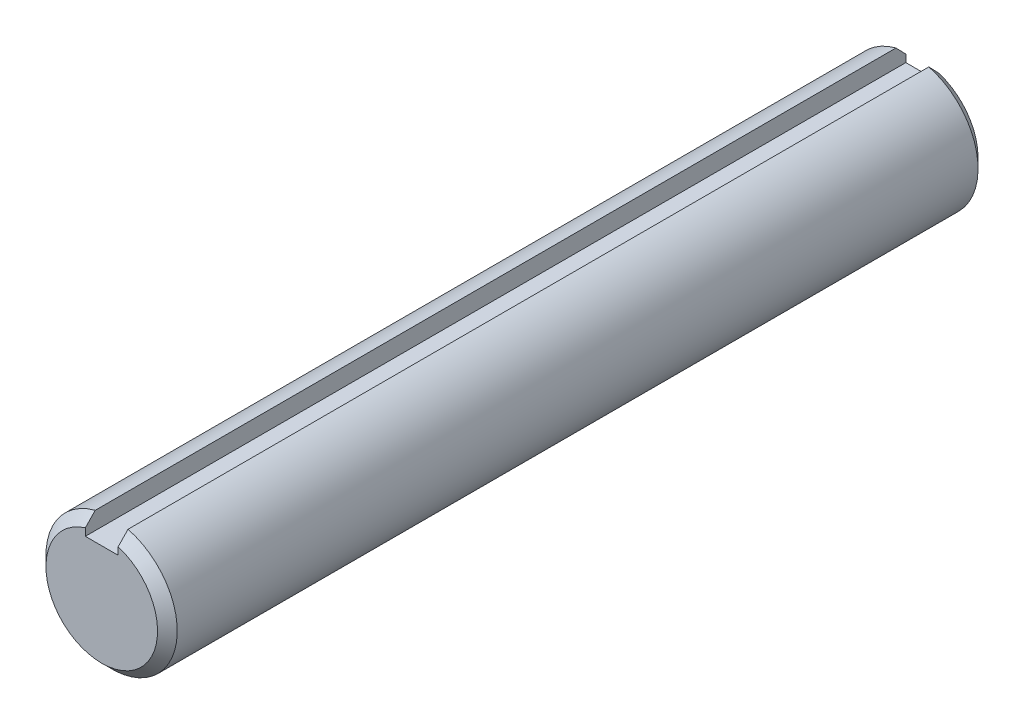
from build123d import *

# Parameters (mm, degrees)
SKETCH1_R           = 4
EXTRUDE1_DEPTH      = 25
CHAMFER1_SIZE       = 0.6
EXTRUDE2_DEPTH      = 26.632011236
EXTRUDE2_DEPTH_BACK = 26.632011236
SKETCH3_W           = 2
SKETCH3_H           = 1.2


with BuildPart() as part:
    # Sketch1 → Extrude1 (new, symmetric)
    with BuildSketch(Plane.XY):
        Circle(SKETCH1_R)
    extrude(amount=EXTRUDE1_DEPTH, both=True)

    # Chamfer1
    chamfer1_edges = [part.edges().sort_by_distance(p)[0] for p in [
        (-4, 0, -25),
        (-4, 0, 25),
    ]]
    chamfer(chamfer1_edges, length=CHAMFER1_SIZE)

    # Sketch3 → Extrude2 (cut, two sides: drawn at the far end of the back side and taken through both)
    with BuildSketch(Plane.XY.offset(-EXTRUDE2_DEPTH_BACK)):
        with Locations((0, 3.4)):
            Rectangle(SKETCH3_W, SKETCH3_H)
    extrude(amount=EXTRUDE2_DEPTH + EXTRUDE2_DEPTH_BACK, mode=Mode.SUBTRACT)


solid = part.part
